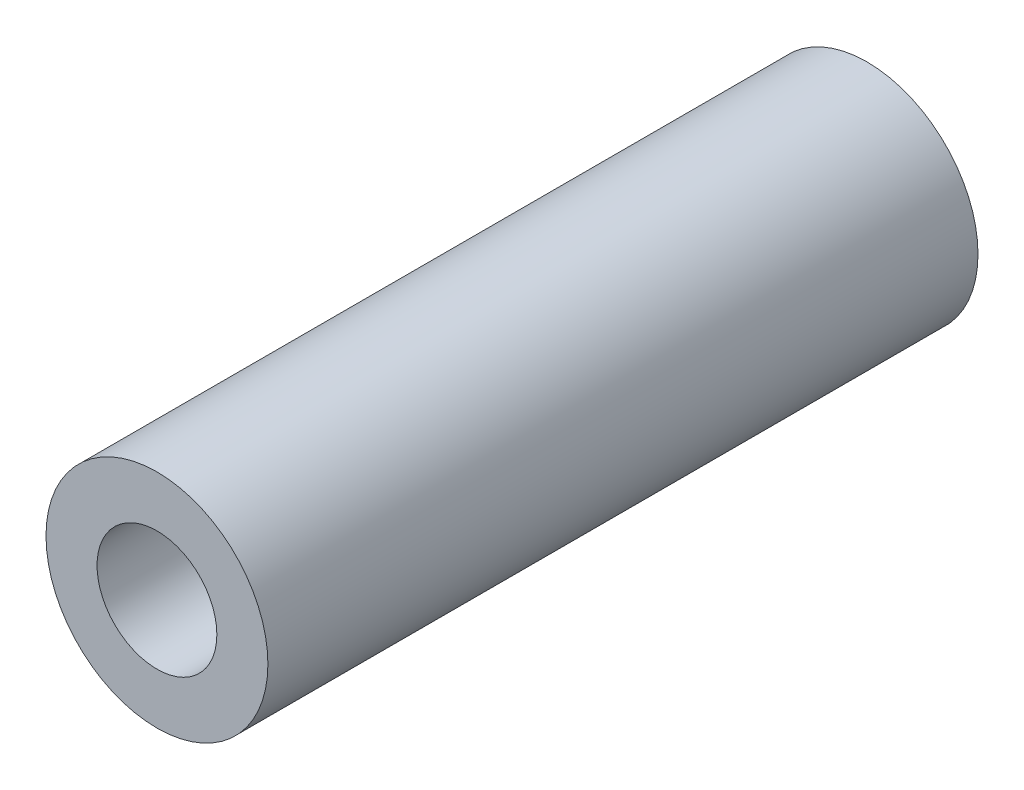
from build123d import *

# Parameters (mm, degrees)
CROQUIS1_R                     = 2.5
SALIENTE_EXTRUIR1_DEPTH        = 16
TALADRO_DE_MARGEN_PARA_M2_51_D = 2.7


with BuildPart() as part:
    # Croquis1 → Saliente-Extruir1 (new body)
    with BuildSketch(Plane.XY):
        Circle(CROQUIS1_R)
    extrude(amount=SALIENTE_EXTRUIR1_DEPTH)

    # Taladro de margen para M2.51 (through all)
    with Locations(Plane.XY.offset(16)):
        with Locations((0, 0)):
            Hole(TALADRO_DE_MARGEN_PARA_M2_51_D / 2)


solid = part.part
